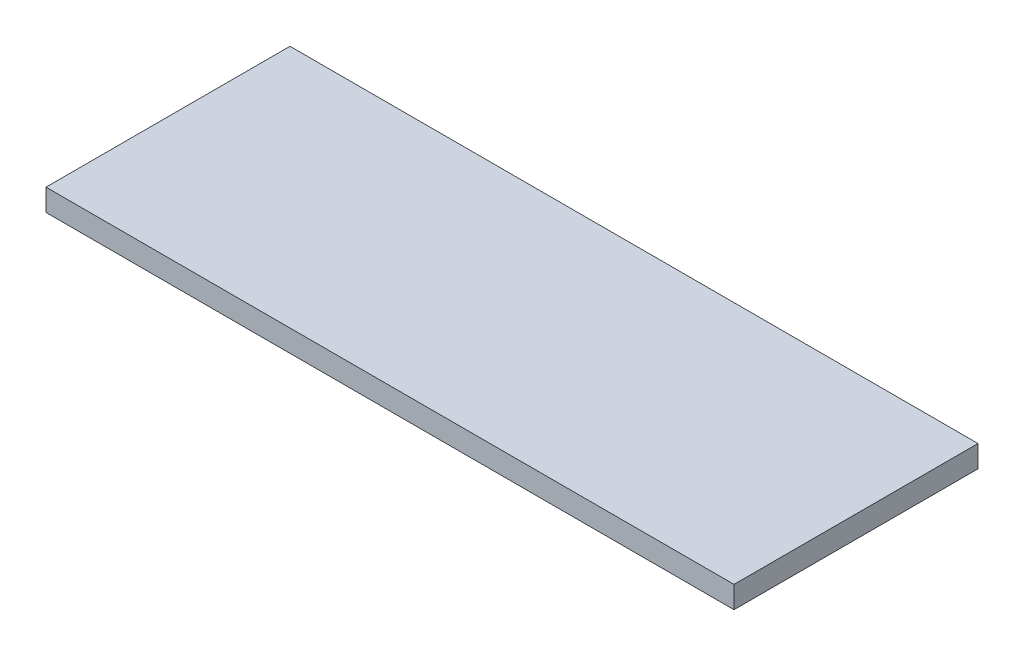
from build123d import *

# Parameters (mm, degrees)
SZKIC1_W                    = 564
SZKIC1_H                    = 200
DODANIE_WYCI_GNI_CIE1_DEPTH = 18


with BuildPart() as part:
    # Szkic1 → Dodanie-wyciągnięcie1 (new body)
    with BuildSketch(Plane(origin=(0, 0, 0), x_dir=(1, 0, 0), z_dir=(0, 1, 0))):
        with Locations((-282, 100)):
            Rectangle(SZKIC1_W, SZKIC1_H)
    extrude(amount=DODANIE_WYCI_GNI_CIE1_DEPTH)


solid = part.part
